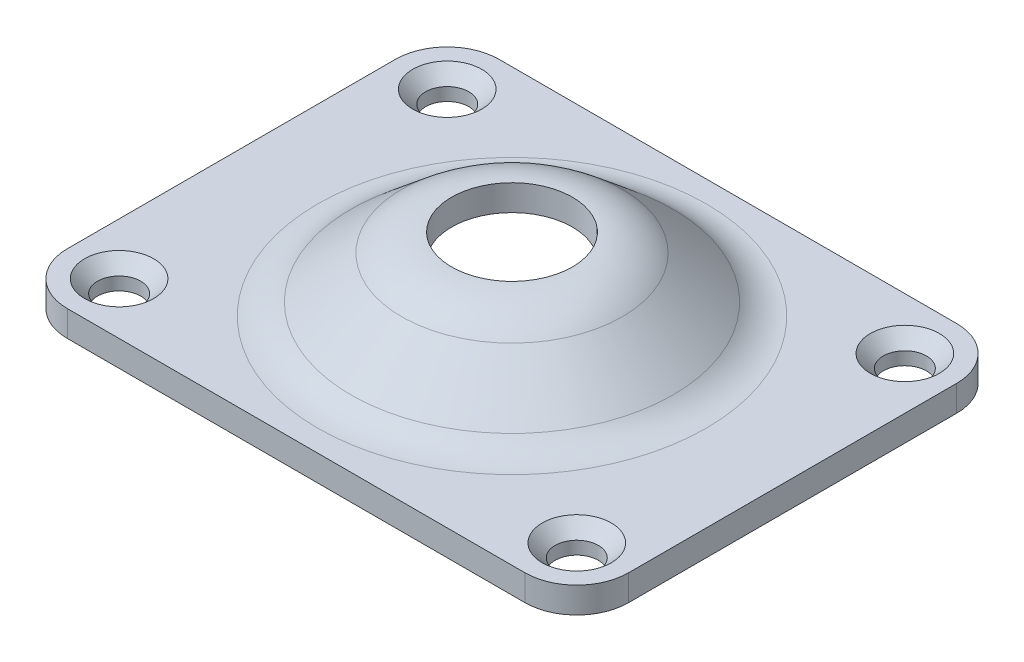
from build123d import *

# Parameters (mm, degrees)
SKETCH1_R           = 2.5
SKETCH1_R_2         = 22.5
BOSS_EXTRUDE1_DEPTH = 3
CHAMFER1_SIZE       = 1.5


with BuildPart() as part:
    # Sketch1 → Boss-Extrude1 (new body)
    with BuildSketch(Plane(origin=(0, 0, 0), x_dir=(1, 0, 0), z_dir=(0, 1, 0))):
        with BuildLine():
            Line((-26.5, -25), (26.5, -25))
            ThreePointArc((26.5, -25), (30.742640687, -23.242640687), (32.5, -19))
            Line((32.5, -19), (32.5, 19))
            ThreePointArc((32.5, 19), (30.742640687, 23.242640687), (26.5, 25))
            Line((26.5, 25), (-26.5, 25))
            ThreePointArc((-26.5, 25), (-30.742640687, 23.242640687), (-32.5, 19))
            Line((-32.5, 19), (-32.5, -19))
            ThreePointArc((-32.5, -19), (-30.742640687, -23.242640687), (-26.5, -25))
        make_face()
        with Locations(Location((-26.5, -19, 0), (0, 0, 270))):
            Circle(SKETCH1_R, mode=Mode.SUBTRACT)
        with Locations(Location((-26.5, 19, 0), (0, 0, 270))):
            Circle(SKETCH1_R, mode=Mode.SUBTRACT)
        with Locations(Location((26.5, 19, 0), (0, 0, 270))):
            Circle(SKETCH1_R, mode=Mode.SUBTRACT)
        with Locations(Location((26.5, -19, 0), (0, 0, 270))):
            Circle(SKETCH1_R, mode=Mode.SUBTRACT)
        with Locations(Location((0, 0, 0), (0, 0, 270))):
            Circle(SKETCH1_R_2, mode=Mode.SUBTRACT)
    extrude(amount=BOSS_EXTRUDE1_DEPTH)

    # Sketch2 → Revolve1 (revolve)
    with BuildSketch(Plane.XY, mode=Mode.PRIVATE) as revolve1_sk:
        with BuildLine():
            Line((-18.643274342, 4.403733341), (-12.785088487, 9.319334931))
            ThreePointArc((-12.785088487, 9.319334931), (-10.07818129, 10.88216853), (-7, 11.424934943))
            Line((-7, 11.424934943), (-7, 8.424934943))
            ThreePointArc((-7, 8.424934943), (-9.05212086, 8.063090668), (-10.856725658, 7.021201602))
            Line((-10.856725658, 7.021201602), (-16.714911513, 2.105600012))
            ThreePointArc((-16.714911513, 2.105600012), (-19.42181871, 0.542766413), (-22.5, 0))
            Line((-22.5, 0), (-22.5, 3))
            ThreePointArc((-22.5, 3), (-20.44787914, 3.361844275), (-18.643274342, 4.403733341))
        make_face()
    revolve(revolve1_sk.sketch.rotate(Axis((0, 0, 0), (0, 1, 0)), 180), axis=Axis((0, 0, 0), (0, 1, 0)))

    # Chamfer1
    chamfer1_edges = [part.edges().sort_by_distance(p)[0] for p in [
        (-26.5, 3, 16.5),
        (-26.5, 3, -21.5),
        (26.5, 3, -21.5),
        (26.5, 3, 16.5),
    ]]
    chamfer(chamfer1_edges, length=CHAMFER1_SIZE)


solid = part.part
